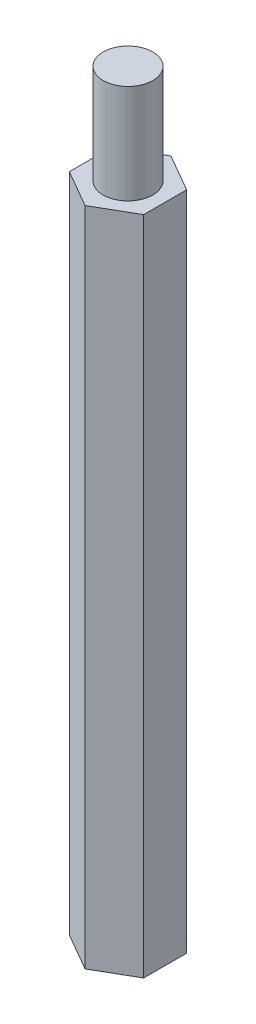
from build123d import *

# Parameters (mm, degrees)
BOSS_EXTRUDE1_DEPTH = 40
SKETCH2_R           = 1.5
CUT_EXTRUDE1_DEPTH  = 40
SKETCH3_R           = 1.5
BOSS_EXTRUDE2_DEPTH = 6


with BuildPart() as part:
    # Sketch1 → Boss-Extrude1 (new body)
    with BuildSketch(Plane(origin=(0, 0, 0), x_dir=(1, 0, 0), z_dir=(0, 1, 0))):
        Polygon((0, 2.598076211), (-2.25, 1.299038106), (-2.25, -1.299038106), (0, -2.598076211), (2.25, -1.299038106), (2.25, 1.299038106), align=None)
    extrude(amount=BOSS_EXTRUDE1_DEPTH)

    # Sketch2 → Cut-Extrude1 (cut)
    with BuildSketch(Plane(origin=(0, 40, 0), x_dir=(1, 0, 0), z_dir=(0, 1, 0))):
        with Locations(Location((0, 0, 0), (0, 0, 270))):
            Circle(SKETCH2_R)
    extrude(amount=-CUT_EXTRUDE1_DEPTH, mode=Mode.SUBTRACT)


with BuildPart() as body_2:
    # Sketch3 → Boss-Extrude2 (new body)
    with BuildSketch(Plane(origin=(0, 40, 0), x_dir=(1, 0, 0), z_dir=(0, 1, 0))):
        with Locations(Location((0, 0, 0), (0, 0, 270))):
            Circle(SKETCH3_R)
    extrude(amount=BOSS_EXTRUDE2_DEPTH)


solid = Compound([part.part, body_2.part])
